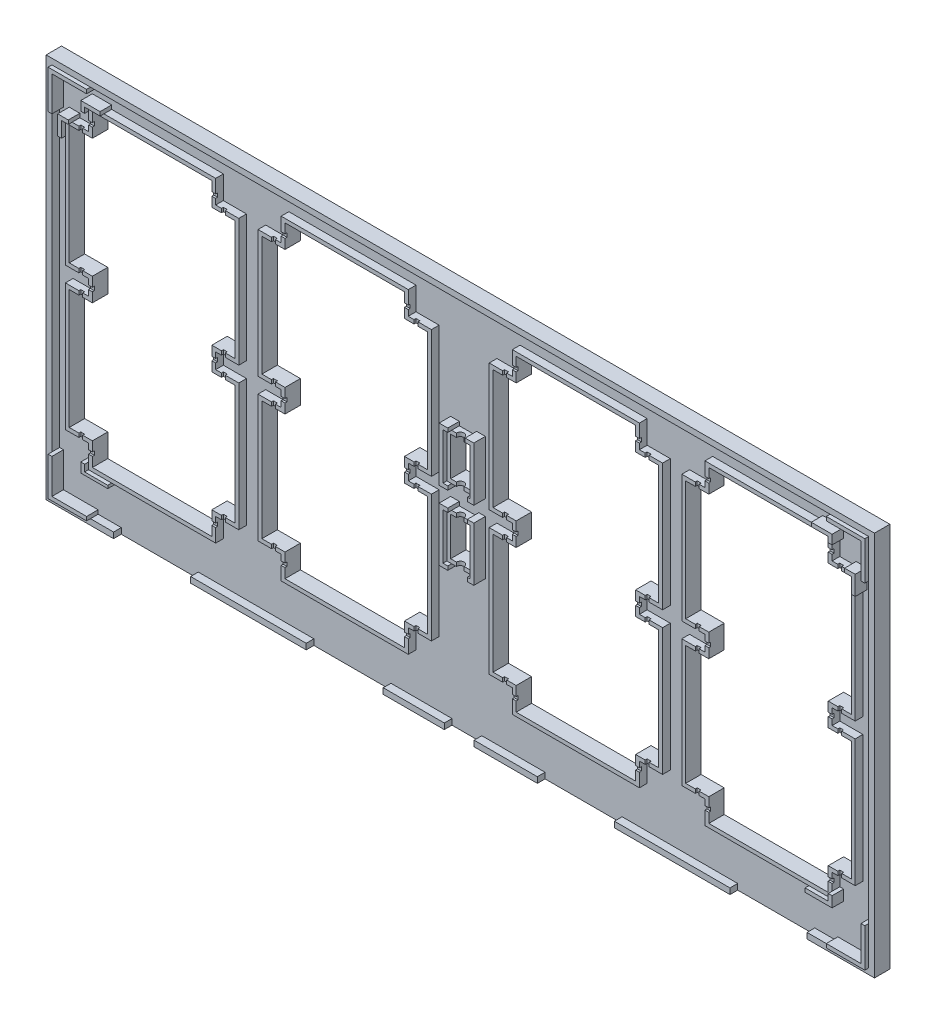
from build123d import *

# Parameters (mm, degrees)
SKETCH_1_W           = 210
SKETCH_1_H           = 100
EXTRUDE_1_DEPTH      = 2
CUT_EXTRUDE_1_DEPTH  = 2
SKETCH_3_W           = 5
SKETCH_3_H           = 10
CUT_EXTRUDE_2_DEPTH  = 2
EXTRUDE_3_DEPTH      = 2
EXTRUDE_4_DEPTH      = 2
SKETCH_7_W           = 2.5
SKETCH_7_H           = 100
EXTRUDE_5_DEPTH      = 2
SKETCH_8_W           = 2.5
SKETCH_8_H           = 100
EXTRUDE_6_DEPTH      = 2
SKETCH_9_W           = 7
SKETCH_9_H           = 12
SKETCH_9_W_2         = 5
SKETCH_9_H_2         = 10
EXTRUDE_7_DEPTH      = 2
SKETCH_10_W          = 7
SKETCH_10_H          = 12
SKETCH_10_W_2        = 5
SKETCH_10_H_2        = 10
EXTRUDE_8_DEPTH      = 2
EXTRUDE_9_DEPTH      = 2
EXTRUDE_10_DEPTH     = 2
SKETCH_13_W          = 215
SKETCH_13_H          = 100
SKETCH_13_W_2        = 212
SKETCH_13_H_2        = 97
EXTRUDE_12_DEPTH     = 2
CUT_EXTRUDE_5_DEPTH  = 0.5
CUT_EXTRUDE_6_DEPTH  = 0.5
SKETCH_18_R          = 1
CUT_EXTRUDE_8_DEPTH  = 40
CUT_EXTRUDE_9_DEPTH  = 0.5
CUT_EXTRUDE_10_DEPTH = 0.5
CUT_EXTRUDE_11_DEPTH = 0.5
CUT_EXTRUDE_12_DEPTH = 0.5
CUT_EXTRUDE_13_DEPTH = 0.5
CUT_EXTRUDE_14_DEPTH = 0.5
CUT_EXTRUDE_15_DEPTH = 0.5
CUT_EXTRUDE_16_DEPTH = 0.5
CUT_EXTRUDE_17_DEPTH = 0.5
SKETCH_28_W          = 20
SKETCH_28_H          = 5.141542118
CUT_EXTRUDE_18_DEPTH = 2
SKETCH_29_W          = 7.735250041
SKETCH_29_H          = 4.76830482
CUT_EXTRUDE_19_DEPTH = 2
EXTRUDE_13_DEPTH     = 3


with BuildPart() as part:
    # Эскиз1 → Бобышка-Вытянуть1 (new body)
    with BuildSketch(Plane.XY):
        with Locations((105, 50)):
            Rectangle(SKETCH_1_W, SKETCH_1_H)
    extrude(amount=EXTRUDE_1_DEPTH)

    # Эскиз2 → Вырез-Вытянуть1 (cut)
    with BuildSketch(Plane.XY.offset(2)):
        Polygon((3.5, 56.25158028), (9.5, 56.25158028), (9.5, 50.25158028), (3.5, 50.25158028), (3.5, 19.25158028), (9.5, 19.25158028), (9.5, 13.25158028), (40.5, 13.25158028), (40.5, 19.25158028), (46.5, 19.25158028), (46.5, 50.25158028), (40.5, 50.25158028), (40.5, 56.25158028), (46.5, 56.25158028), (46.5, 87.25158028), (40.5, 87.25158028), (40.5, 93.25158028), (9.5, 93.25158028), (9.5, 87.25158028), (3.5, 87.25158028), align=None)
        Polygon((53.5, 56.25158028), (59.5, 56.25158028), (59.5, 50.25158028), (53.5, 50.25158028), (53.5, 19.25158028), (59.5, 19.25158028), (59.5, 13.25158028), (90.5, 13.25158028), (90.5, 19.25158028), (96.5, 19.25158028), (96.5, 50.25158028), (90.5, 50.25158028), (90.5, 56.25158028), (96.5, 56.25158028), (96.5, 87.25158028), (90.5, 87.25158028), (90.5, 93.25158028), (59.5, 93.25158028), (59.5, 87.25158028), (53.5, 87.25158028), align=None)
        Polygon((113.5, 56.25158028), (119.5, 56.25158028), (119.5, 50.25158028), (113.5, 50.25158028), (113.5, 19.25158028), (119.5, 19.25158028), (119.5, 13.25158028), (150.5, 13.25158028), (150.5, 19.25158028), (156.5, 19.25158028), (156.5, 50.25158028), (150.5, 50.25158028), (150.5, 56.25158028), (156.5, 56.25158028), (156.5, 87.25158028), (150.5, 87.25158028), (150.5, 93.25158028), (119.5, 93.25158028), (119.5, 87.25158028), (113.5, 87.25158028), align=None)
        Polygon((163.5, 56.25158028), (169.5, 56.25158028), (169.5, 50.25158028), (163.5, 50.25158028), (163.5, 19.25158028), (169.5, 19.25158028), (169.5, 13.25158028), (200.5, 13.25158028), (200.5, 19.25158028), (206.5, 19.25158028), (206.5, 50.25158028), (200.5, 50.25158028), (200.5, 56.25158028), (206.5, 56.25158028), (206.5, 87.25158028), (200.5, 87.25158028), (200.5, 93.25158028), (169.5, 93.25158028), (169.5, 87.25158028), (163.5, 87.25158028), align=None)
    extrude(amount=-CUT_EXTRUDE_1_DEPTH, mode=Mode.SUBTRACT)

    # Эскиз3 → Вырез-Вытянуть2 (cut)
    with BuildSketch(Plane.XY.offset(2)):
        with Locations((105, 62.25158028)):
            Rectangle(SKETCH_3_W, SKETCH_3_H)
        with Locations((105, 44.25158028)):
            Rectangle(SKETCH_3_W, SKETCH_3_H)
    extrude(amount=-CUT_EXTRUDE_2_DEPTH, mode=Mode.SUBTRACT)

    # Эскиз5 → Бобышка-Вытянуть3 (add)
    with BuildSketch(Plane.XY.offset(2)):
        Polygon((8.5, 88.25158028), (8.5, 94.25158028), (41.5, 94.25158028), (41.5, 88.25158028), (47.5, 88.25158028), (47.5, 55.25158028), (41.5, 55.25158028), (41.5, 51.25158028), (47.5, 51.25158028), (47.5, 18.25158028), (41.5, 18.25158028), (41.5, 12.25158028), (8.5, 12.25158028), (8.5, 18.25158028), (2.5, 18.25158028), (2.5, 51.25158028), (8.5, 51.25158028), (8.5, 55.25158028), (2.5, 55.25158028), (2.5, 88.25158028), align=None)
        Polygon((9.5, 93.25158028), (40.5, 93.25158028), (40.5, 87.25158028), (46.5, 87.25158028), (46.5, 56.25158028), (40.5, 56.25158028), (40.5, 50.25158028), (46.5, 50.25158028), (46.5, 19.25158028), (40.5, 19.25158028), (40.5, 13.25158028), (9.5, 13.25158028), (9.5, 19.25158028), (3.5, 19.25158028), (3.5, 50.25158028), (9.5, 50.25158028), (9.5, 56.25158028), (3.5, 56.25158028), (3.5, 87.25158028), (9.5, 87.25158028), align=None, mode=Mode.SUBTRACT)
    extrude(amount=EXTRUDE_3_DEPTH)

    # Эскиз6 → Бобышка-Вытянуть4 (add)
    with BuildSketch(Plane.XY.offset(2)):
        Polygon((58.5, 88.25158028), (58.5, 94.25158028), (91.5, 94.25158028), (91.5, 88.25158028), (97.5, 88.25158028), (97.5, 55.25158028), (91.5, 55.25158028), (91.5, 51.25158028), (97.5, 51.25158028), (97.5, 18.25158028), (91.5, 18.25158028), (91.5, 12.25158028), (58.5, 12.25158028), (58.5, 18.25158028), (52.5, 18.25158028), (52.5, 51.25158028), (58.5, 51.25158028), (58.5, 55.25158028), (52.5, 55.25158028), (52.5, 88.25158028), align=None)
        Polygon((59.5, 93.25158028), (90.5, 93.25158028), (90.5, 87.25158028), (96.5, 87.25158028), (96.5, 56.25158028), (90.5, 56.25158028), (90.5, 50.25158028), (96.5, 50.25158028), (96.5, 19.25158028), (90.5, 19.25158028), (90.5, 13.25158028), (59.5, 13.25158028), (59.5, 19.25158028), (53.5, 19.25158028), (53.5, 50.25158028), (59.5, 50.25158028), (59.5, 56.25158028), (53.5, 56.25158028), (53.5, 87.25158028), (59.5, 87.25158028), align=None, mode=Mode.SUBTRACT)
    extrude(amount=EXTRUDE_4_DEPTH)

    # Эскиз7 → Бобышка-Вытянуть5 (add)
    with BuildSketch(Plane.XY.offset(2)):
        with Locations((-1.25, 50)):
            Rectangle(SKETCH_7_W, SKETCH_7_H)
    extrude(amount=-EXTRUDE_5_DEPTH)

    # Эскиз8 → Бобышка-Вытянуть6 (add)
    with BuildSketch(Plane.XY.offset(2)):
        with Locations((211.25, 50)):
            Rectangle(SKETCH_8_W, SKETCH_8_H)
    extrude(amount=-EXTRUDE_6_DEPTH)

    # Эскиз9 → Бобышка-Вытянуть7 (add)
    with BuildSketch(Plane.XY.offset(2)):
        with Locations((105, 62.25158028)):
            Rectangle(SKETCH_9_W, SKETCH_9_H)
        with Locations((105, 62.25158028)):
            Rectangle(SKETCH_9_W_2, SKETCH_9_H_2, mode=Mode.SUBTRACT)
    extrude(amount=EXTRUDE_7_DEPTH)

    # Эскиз10 → Бобышка-Вытянуть8 (add)
    with BuildSketch(Plane.XY.offset(2)):
        with Locations((105, 44.25158028)):
            Rectangle(SKETCH_10_W, SKETCH_10_H)
        with Locations((105, 44.25158028)):
            Rectangle(SKETCH_10_W_2, SKETCH_10_H_2, mode=Mode.SUBTRACT)
    extrude(amount=EXTRUDE_8_DEPTH)

    # Эскиз11 → Бобышка-Вытянуть9 (add)
    with BuildSketch(Plane.XY.offset(2)):
        Polygon((118.5, 88.25158028), (118.5, 94.25158028), (151.5, 94.25158028), (151.5, 88.25158028), (157.5, 88.25158028), (157.5, 55.25158028), (151.5, 55.25158028), (151.5, 51.25158028), (157.5, 51.25158028), (157.5, 18.25158028), (151.5, 18.25158028), (151.5, 12.25158028), (118.5, 12.25158028), (118.5, 18.25158028), (112.5, 18.25158028), (112.5, 51.25158028), (118.5, 51.25158028), (118.5, 55.25158028), (112.5, 55.25158028), (112.5, 88.25158028), align=None)
        Polygon((119.5, 93.25158028), (150.5, 93.25158028), (150.5, 87.25158028), (156.5, 87.25158028), (156.5, 56.25158028), (150.5, 56.25158028), (150.5, 50.25158028), (156.5, 50.25158028), (156.5, 19.25158028), (150.5, 19.25158028), (150.5, 13.25158028), (119.5, 13.25158028), (119.5, 19.25158028), (113.5, 19.25158028), (113.5, 50.25158028), (119.5, 50.25158028), (119.5, 56.25158028), (113.5, 56.25158028), (113.5, 87.25158028), (119.5, 87.25158028), align=None, mode=Mode.SUBTRACT)
    extrude(amount=EXTRUDE_9_DEPTH)

    # Эскиз12 → Бобышка-Вытянуть10 (add)
    with BuildSketch(Plane.XY.offset(2)):
        Polygon((168.5, 88.25158028), (168.5, 94.25158028), (201.5, 94.25158028), (201.5, 88.25158028), (207.5, 88.25158028), (207.5, 55.25158028), (201.5, 55.25158028), (201.5, 51.25158028), (207.5, 51.25158028), (207.5, 18.25158028), (201.5, 18.25158028), (201.5, 12.25158028), (168.5, 12.25158028), (168.5, 18.25158028), (162.5, 18.25158028), (162.5, 51.25158028), (168.5, 51.25158028), (168.5, 55.25158028), (162.5, 55.25158028), (162.5, 88.25158028), align=None)
        Polygon((169.5, 93.25158028), (200.5, 93.25158028), (200.5, 87.25158028), (206.5, 87.25158028), (206.5, 56.25158028), (200.5, 56.25158028), (200.5, 50.25158028), (206.5, 50.25158028), (206.5, 19.25158028), (200.5, 19.25158028), (200.5, 13.25158028), (169.5, 13.25158028), (169.5, 19.25158028), (163.5, 19.25158028), (163.5, 50.25158028), (169.5, 50.25158028), (169.5, 56.25158028), (163.5, 56.25158028), (163.5, 87.25158028), (169.5, 87.25158028), align=None, mode=Mode.SUBTRACT)
    extrude(amount=EXTRUDE_10_DEPTH)

    # Эскиз13 → Бобышка-Вытянуть12 (add)
    with BuildSketch(Plane.XY.offset(2)):
        with Locations((105, 50)):
            Rectangle(SKETCH_13_W, SKETCH_13_H)
        with Locations((105, 50)):
            Rectangle(SKETCH_13_W_2, SKETCH_13_H_2, mode=Mode.SUBTRACT)
    extrude(amount=EXTRUDE_12_DEPTH)

    # Эскиз15 → Вырез-Вытянуть5 (cut)
    with BuildSketch(Plane.XY.offset(4)):
        Polygon((7, 87.846695126), (7, 16.428250705), (6, 16.428250705), (6, 89.715353261), (7, 89.715353261), align=None)
    extrude(amount=-CUT_EXTRUDE_5_DEPTH, mode=Mode.SUBTRACT)

    # Эскиз16 → Вырез-Вытянуть6 (cut)
    with BuildSketch(Plane.XY.offset(4)):
        Polygon((9.5, 53.75158028), (207.235738324, 53.75158028), (207.235738324, 52.75158028), (7.033108755, 52.75158028), (7.033108755, 53.75158028), align=None)
    extrude(amount=-CUT_EXTRUDE_6_DEPTH, mode=Mode.SUBTRACT)

    # Эскиз18 → Вырез-Вытянуть8 (cut)
    with BuildSketch(Plane.XZ.offset(-38.25158028)):
        with Locations((105, 4)):
            Circle(SKETCH_18_R)
    extrude(amount=-CUT_EXTRUDE_8_DEPTH, mode=Mode.SUBTRACT)

    # Эскиз19 → Вырез-Вытянуть9 (cut)
    with BuildSketch(Plane.XY.offset(4)):
        Polygon((9.5, 16.75158028), (205.637089943, 16.75158028), (205.637089943, 15.75158028), (6.346061877, 15.75158028), (6.346061877, 16.75158028), align=None)
    extrude(amount=-CUT_EXTRUDE_9_DEPTH, mode=Mode.SUBTRACT)

    # Эскиз20 → Вырез-Вытянуть10 (cut)
    with BuildSketch(Plane.XY.offset(4)):
        Polygon((9.5, 90.75158028), (205.985832095, 90.75158028), (205.985832095, 89.75158028), (6.902004975, 89.75158028), (6.902004975, 90.75158028), align=None)
    extrude(amount=-CUT_EXTRUDE_10_DEPTH, mode=Mode.SUBTRACT)

    # Эскиз21 → Вырез-Вытянуть11 (cut)
    with BuildSketch(Plane.XY.offset(4)):
        Polygon((44, 87.25158028), (44, 14.66925504), (43, 14.66925504), (43, 89.404001718), (44, 89.404001718), align=None)
    extrude(amount=-CUT_EXTRUDE_11_DEPTH, mode=Mode.SUBTRACT)

    # Эскиз22 → Вырез-Вытянуть12 (cut)
    with BuildSketch(Plane.XY.offset(4)):
        Polygon((57, 87.25158028), (57, 16.867025175), (56, 16.867025175), (56, 91.235802404), (57, 91.235802404), align=None)
    extrude(amount=-CUT_EXTRUDE_12_DEPTH, mode=Mode.SUBTRACT)

    # Эскиз23 → Вырез-Вытянуть13 (cut)
    with BuildSketch(Plane.XY.offset(4)):
        Polygon((94, 19.25158028), (94, 90.827406377), (93, 90.827406377), (93, 16.223092633), (94, 16.223092633), align=None)
    extrude(amount=-CUT_EXTRUDE_13_DEPTH, mode=Mode.SUBTRACT)

    # Эскиз24 → Вырез-Вытянуть14 (cut)
    with BuildSketch(Plane.XY.offset(4)):
        Polygon((116, 19.25158028), (116, 17.281770107), (117, 17.281770107), (117, 91.111451252), (116, 91.111451252), align=None)
    extrude(amount=-CUT_EXTRUDE_14_DEPTH, mode=Mode.SUBTRACT)

    # Эскиз25 → Вырез-Вытянуть15 (cut)
    with BuildSketch(Plane.XY.offset(4)):
        Polygon((154, 19.25158028), (154, 16.478696583), (153, 16.478696583), (153, 93.52809477), (154, 93.52809477), align=None)
    extrude(amount=-CUT_EXTRUDE_15_DEPTH, mode=Mode.SUBTRACT)

    # Эскиз26 → Вырез-Вытянуть16 (cut)
    with BuildSketch(Plane.XY.offset(4)):
        Polygon((167, 87.25158028), (167, 89.746112194), (166, 89.746112194), (166, 15.475937203), (167, 15.475937203), align=None)
    extrude(amount=-CUT_EXTRUDE_16_DEPTH, mode=Mode.SUBTRACT)

    # Эскиз27 → Вырез-Вытянуть17 (cut)
    with BuildSketch(Plane.XY.offset(4)):
        Polygon((204, 19.25158028), (204, 15.504103959), (203, 15.504103959), (203, 91.252841114), (204, 91.252841114), align=None)
    extrude(amount=-CUT_EXTRUDE_17_DEPTH, mode=Mode.SUBTRACT)

    # Эскиз28 → Вырез-Вытянуть18 (cut)
    with BuildSketch(Plane.XY.offset(2)):
        with Locations((25, 0.992347307)):
            Rectangle(SKETCH_28_W, SKETCH_28_H)
        with Locations((75, 0.992347307)):
            Rectangle(SKETCH_28_W, SKETCH_28_H)
        with Locations((135, 0.992347307)):
            Rectangle(SKETCH_28_W, SKETCH_28_H)
        with Locations((185, 0.992347307)):
            Rectangle(SKETCH_28_W, SKETCH_28_H)
    extrude(amount=CUT_EXTRUDE_18_DEPTH, mode=Mode.SUBTRACT)

    # Эскиз29 → Вырез-Вытянуть19 (cut)
    with BuildSketch(Plane.XY.offset(2)):
        with Locations((104.718144824, 0.7951442)):
            Rectangle(SKETCH_29_W, SKETCH_29_H)
    extrude(amount=CUT_EXTRUDE_19_DEPTH, mode=Mode.SUBTRACT)

    # Эскиз30 → Бобышка-Вытянуть13 (add)
    with BuildSketch(Plane.XY.offset(2)):
        Polygon((-1, 98.5), (9, 98.5), (9, 97.5), (0, 97.5), (0, 88.5), (-1, 88.5), align=None)
        Polygon((8.5, 94.25158028), (12.5, 94.25158028), (12.5, 95.25158028), (7.5, 95.25158028), (7.5, 92.846645174), (8.5, 92.846645174), align=None)
        Polygon((2.5, 88.25158028), (4.25, 88.25158028), (4.25, 89.25158028), (1.5, 89.25158028), (1.5, 84.25158028), (2.5, 84.25158028), align=None)
        Polygon((-1, 1.5), (9, 1.5), (9, 2.5), (0, 2.5), (0, 11.5), (-1, 11.5), align=None)
        Polygon((8.5, 14.00158028), (7.5, 14.00158028), (7.5, 11.50158028), (14.5, 11.50158028), (14.5, 12.25158028), (8.5, 12.25158028), align=None)
        Polygon((211, 98.5), (211, 88.5), (210, 88.5), (210, 97.5), (201, 97.5), (201, 98.5), align=None)
        Polygon((197.098492519, 94.25158028), (197.098492519, 95.25158028), (202.5, 95.25158028), (202.5, 92.85158028), (201.5, 92.85158028), (201.5, 94.25158028), align=None)
        Polygon((205.75, 88.25158028), (205.75, 89.25158028), (208.5, 89.25158028), (208.5, 84.25158028), (207.5, 84.25158028), (207.5, 88.25158028), align=None)
        Polygon((201, 1.5), (211, 1.5), (211, 11.50158028), (210, 11.50158028), (210, 2.5), (201, 2.5), align=None)
        Polygon((195.5, 12.25158028), (195.5, 11.25158028), (202.5, 11.25158028), (202.5, 14.00158028), (201.5, 14.00158028), (201.5, 12.25158028), align=None)
        Polygon((107.247269867, 68.25158028), (107.247269867, 69.25158028), (109.5, 69.25158028), (109.5, 55.25158028), (107.810534732, 55.25158028), (107.810534732, 56.25158028), (108.5, 56.25158028), (108.5, 68.25158028), align=None)
        Polygon((102.75, 68.25158028), (102.75, 69.25158028), (100.5, 69.25158028), (100.5, 55.25158028), (102.75, 55.25158028), (102.75, 56.25158028), (101.5, 56.25158028), (101.5, 68.25158028), align=None)
        Polygon((107.810534732, 50.25158028), (107.810534732, 51.25158028), (109.5, 51.25158028), (109.5, 37.250232467), (107.810534732, 37.250232467), (107.810534732, 38.25158028), (108.5, 38.25158028), (108.5, 50.25158028), align=None)
        Polygon((102.75, 50.25158028), (102.75, 51.25158028), (100.5, 51.25158028), (100.5, 37.25158028), (102.75, 37.25158028), (102.75, 38.25158028), (101.5, 38.25158028), (101.5, 50.25158028), align=None)
    extrude(amount=EXTRUDE_13_DEPTH)


solid = part.part
